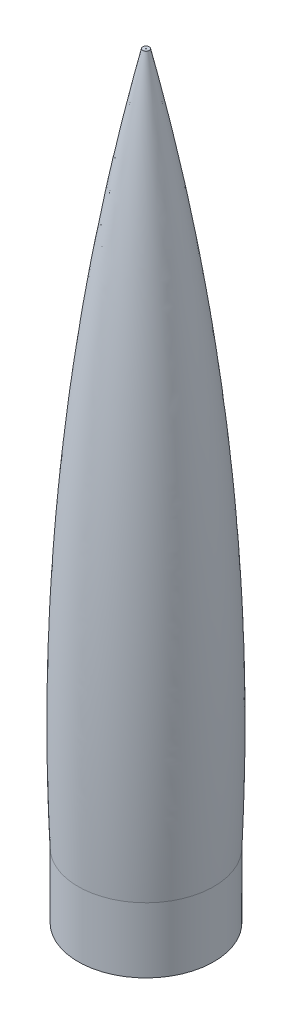
from build123d import *

# Parameters (mm, degrees)
SKETCH2_R           = 52.9463
SKETCH2_R_2         = 50.6857
BOSS_EXTRUDE1_DEPTH = 50.8


with BuildPart() as part:
    # Sketch1 → Revolve1 (revolve)
    with BuildSketch(Plane.XY, mode=Mode.PRIVATE) as revolve1_sk:
        with BuildLine():
            Line((2.5146, 539.75), (0.254, 539.75))
            Line((0.254, 539.75), (27.792678528, 328.137428332))
            Line((27.792678528, 328.137428332), (50.6857, 0))
            Line((50.6857, 0), (52.9463, 0))
            add(Edge.make_bspline(
                [(52.9463, 0), (64.173406071, 271.106946787), (2.5146, 539.75)],
                knots=[0, 0, 0, 1, 1, 1], degree=2))
        make_face()
    revolve(revolve1_sk.sketch.rotate(Axis((0, 0, 0), (0, 1, 0)), 90), axis=Axis((0, 0, 0), (0, 1, 0)))

    # Sketch2 → Boss-Extrude1 (add)
    with BuildSketch(Plane.XZ):
        with Locations(Location((0, 0, 0), (0, 0, 270))):
            Circle(SKETCH2_R)
        with Locations(Location((0, 0, 0), (0, 0, 270))):
            Circle(SKETCH2_R_2, mode=Mode.SUBTRACT)
    extrude(amount=BOSS_EXTRUDE1_DEPTH)


solid = part.part
